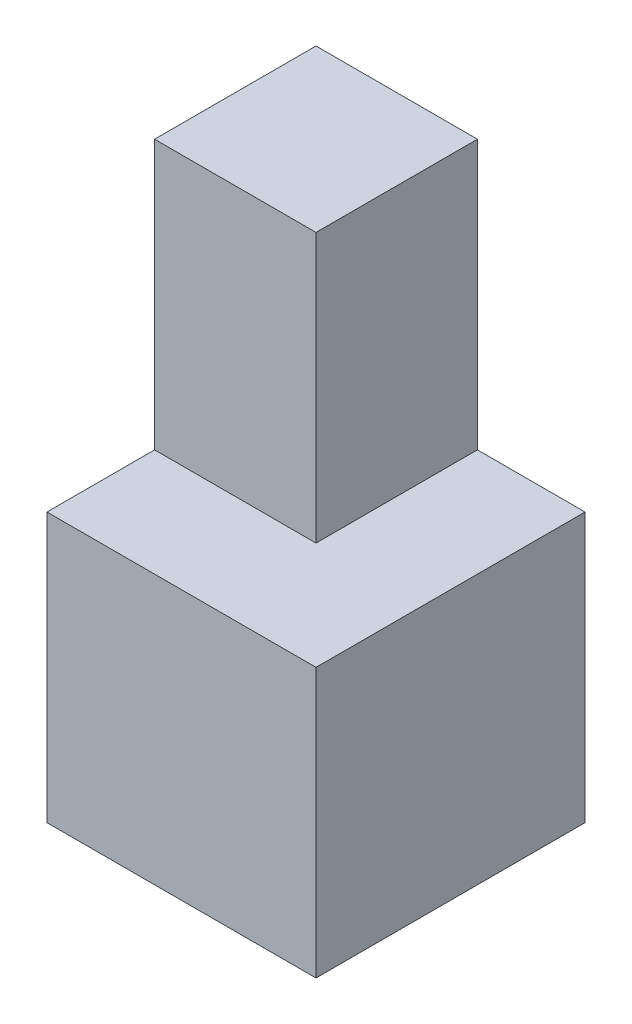
from build123d import *

# Parameters (mm, degrees)
SKETCH1_W           = 1000
SKETCH1_H           = 1000
BOSS_EXTRUDE1_DEPTH = 1000
SKETCH1_3_W         = 600
SKETCH1_3_H         = 600
BOSS_EXTRUDE2_DEPTH = 1000


with BuildPart() as part:
    # Sketch1 → Boss-Extrude1 (new body)
    with BuildSketch(Plane(origin=(0, 0, 0), x_dir=(1, 0, 0), z_dir=(0, 1, 0))):
        with Locations((-300, 300)):
            Rectangle(SKETCH1_W, SKETCH1_H)
    extrude(amount=-BOSS_EXTRUDE1_DEPTH)

    # Sketch1<3> → Boss-Extrude2 (add)
    with BuildSketch(Plane(origin=(0, 0, 0), x_dir=(1, 0, 0), z_dir=(0, 1, 0))):
        with Locations((-500, 500)):
            Rectangle(SKETCH1_3_W, SKETCH1_3_H)
    extrude(amount=BOSS_EXTRUDE2_DEPTH)


solid = part.part
